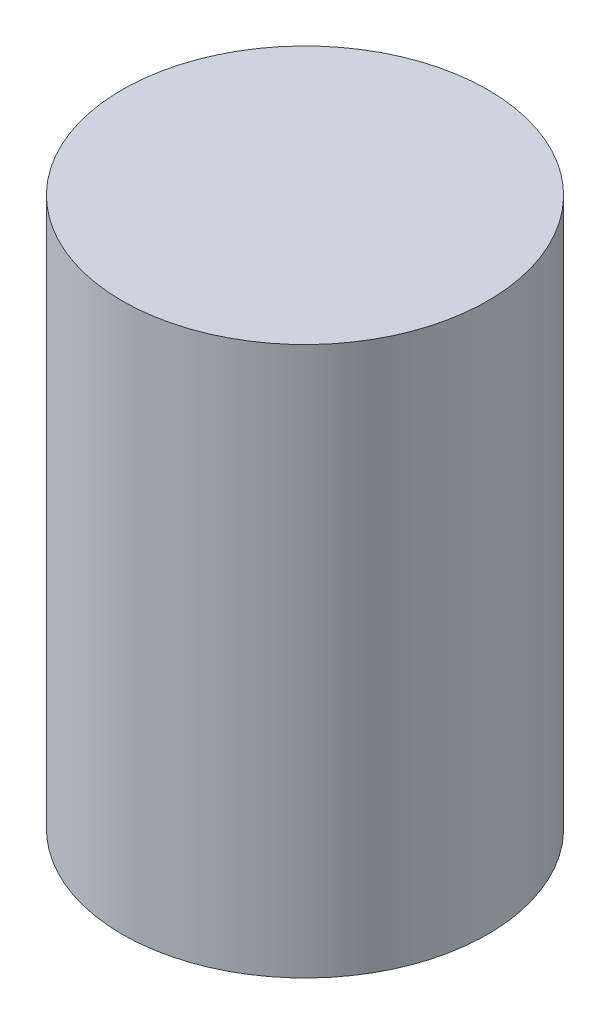
from build123d import *

# Parameters (mm, degrees)
PRESS_COP_KOVASI_30L_D300_START = 1320
SKETCH1_R                       = 150
PRESS_COP_KOVASI_30L_D300_DEPTH = 450


with BuildPart() as part:
    # Sketch1 → PRESS_cop_kovasi_30L_D300 (new body)
    with BuildSketch(Plane(origin=(0, 0, 0), x_dir=(1, 0, 0), z_dir=(0, 1, 0)).offset(PRESS_COP_KOVASI_30L_D300_START)):
        with Locations(Location((185, 300, 0), (0, 0, 270))):
            Circle(SKETCH1_R)
    extrude(amount=PRESS_COP_KOVASI_30L_D300_DEPTH)


solid = part.part
